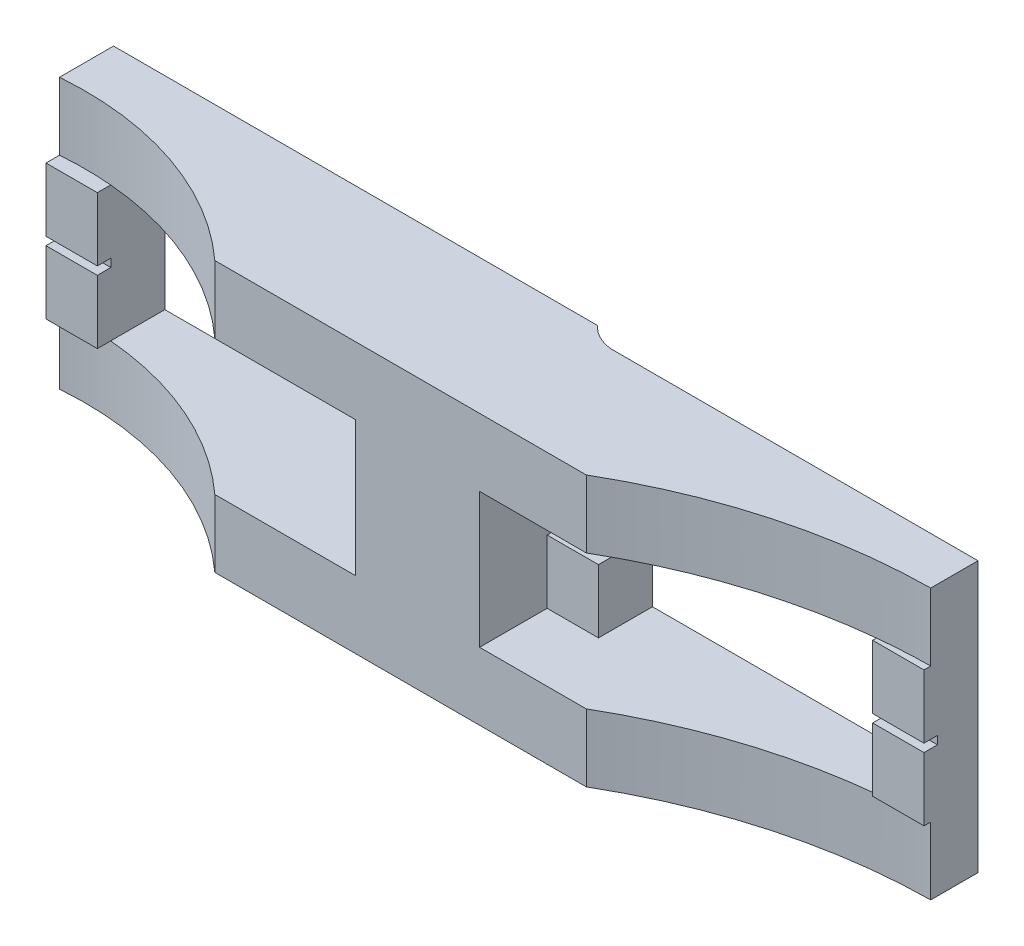
from build123d import *

# Parameters (mm, degrees)
BOSS_EXTRUDE1_DEPTH = 40
SKETCH2_W           = 55.8
SKETCH2_H           = 20
CUT_EXTRUDE1_DEPTH  = 13.5
CUT_EXTRUDE2_REACH  = 79.506
SKETCH3_W           = 40.6
SKETCH3_H           = 20
SKETCH4_W           = 7.6
SKETCH4_H           = 20
BOSS_EXTRUDE2_DEPTH = 3.5
SKETCH5_W           = 55.8
SKETCH5_H           = 1.2
CUT_EXTRUDE3_DEPTH  = 2
SKETCH6_W           = 55.8
SKETCH6_H           = 1.2
CUT_EXTRUDE4_DEPTH  = 2


with BuildPart() as part:
    # Sketch1 → Boss-Extrude1 (new body)
    with BuildSketch(Plane(origin=(0, 0, 0), x_dir=(1, 0, 0), z_dir=(0, 1, 0))):
        with BuildLine():
            Line((65, 8), (23.977973373, 8))
            Line((23.977973373, 8), (10.779053292, 8))
            ThreePointArc((10.779053292, 8), (8.525859954, 8.600007042), (6.661212966, 10))
            Line((6.661212966, 10), (-20, 10))
            Line((-20, 10), (-65, 10))
            Line((-65, 10), (-65, 2))
            ThreePointArc((-65, 2), (-46.256011847, -0.371701222), (-30, -10))
            Line((-30, -10), (-20, -10))
            Line((-20, -10), (17.838709677, -10))
            Line((17.838709677, -10), (20, -10))
            Line((20, -10), (25, -10))
            ThreePointArc((25, -10), (44.283723708, -1.895358938), (65, 1))
            Line((65, 1), (65, 8))
        make_face()
    extrude(amount=BOSS_EXTRUDE1_DEPTH)

    # Sketch2 → Cut-Extrude1 (cut)
    with BuildSketch(Plane.XY.offset(10)):
        with Locations((37.1, 20)):
            Rectangle(SKETCH2_W, SKETCH2_H)
        with Locations((-37.1, 20)):
            Rectangle(SKETCH2_W, SKETCH2_H)
    extrude(amount=-CUT_EXTRUDE1_DEPTH, mode=Mode.SUBTRACT)

    # Sketch3 → Cut-Extrude2 (cut, up to next)
    with BuildSketch(Plane.XY.offset(-3.5), mode=Mode.PRIVATE) as cut_extrude2_sk1:
        with Locations((-37.1, 20)):
            Rectangle(SKETCH3_W, SKETCH3_H)
    cut_extrude2_tool1 = extrude(cut_extrude2_sk1.sketch, amount=-CUT_EXTRUDE2_REACH, mode=Mode.PRIVATE) & part.part
    # Sketch3 → Cut-Extrude2 (cut, up to next)
    with BuildSketch(Plane.XY.offset(-3.5), mode=Mode.PRIVATE) as cut_extrude2_sk2:
        with Locations((37.1, 20)):
            Rectangle(SKETCH3_W, SKETCH3_H)
    cut_extrude2_tool2 = extrude(cut_extrude2_sk2.sketch, amount=-CUT_EXTRUDE2_REACH, mode=Mode.PRIVATE) & part.part
    add(cut_extrude2_tool1.solids().sort_by_distance((-37.1, 20, -3.5))[0], mode=Mode.SUBTRACT)
    add(cut_extrude2_tool2.solids().sort_by_distance((37.1, 20, -3.5))[0], mode=Mode.SUBTRACT)

    # Sketch4 → Boss-Extrude2 (add)
    with BuildSketch(Plane.XY.offset(-3.5)):
        with Locations((-61.2, 20)):
            Rectangle(SKETCH4_W, SKETCH4_H)
        with Locations((-13, 20)):
            Rectangle(SKETCH4_W, SKETCH4_H)
        with Locations((13, 20)):
            Rectangle(SKETCH4_W, SKETCH4_H)
        with Locations((61.2, 20)):
            Rectangle(SKETCH4_W, SKETCH4_H)
    extrude(amount=BOSS_EXTRUDE2_DEPTH)

    # Sketch5 → Cut-Extrude3 (cut)
    with BuildSketch(Plane.XY):
        with Locations((-37.1, 20)):
            Rectangle(SKETCH5_W, SKETCH5_H)
    extrude(amount=-CUT_EXTRUDE3_DEPTH, mode=Mode.SUBTRACT)

    # Sketch6 → Cut-Extrude4 (cut)
    with BuildSketch(Plane.XY):
        with Locations((37.1, 20)):
            Rectangle(SKETCH6_W, SKETCH6_H)
    extrude(amount=-CUT_EXTRUDE4_DEPTH, mode=Mode.SUBTRACT)


solid = part.part
